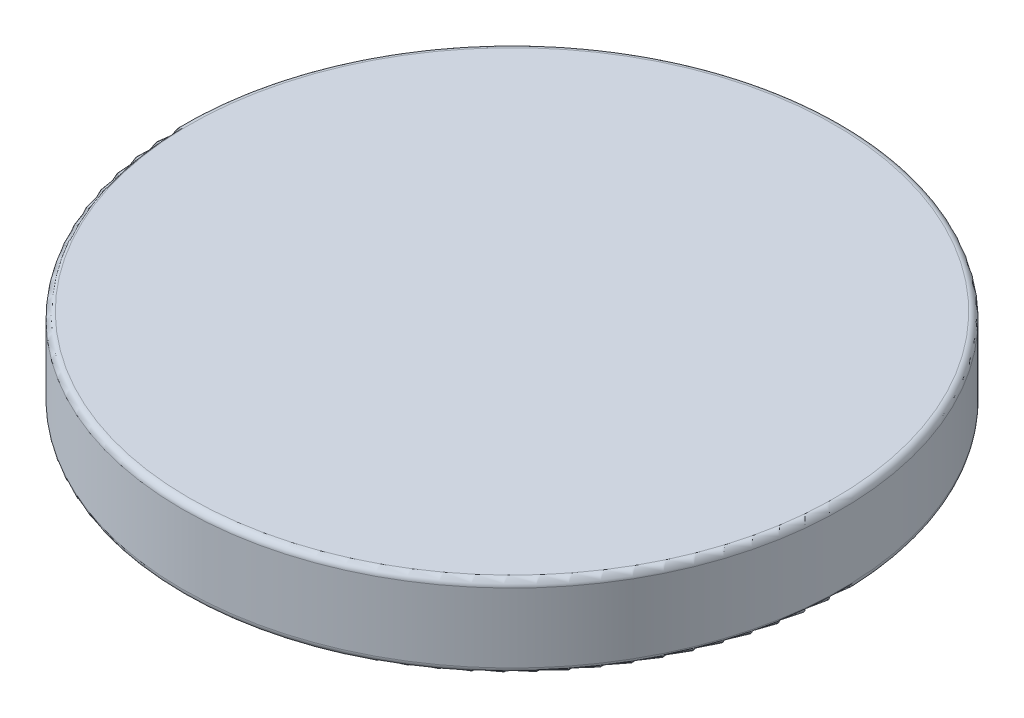
from build123d import *

# Parameters (mm, degrees)
SKETCH1_R           = 12.7
BOSS_EXTRUDE1_DEPTH = 3.175
FILLET1_R           = 0.254


with BuildPart() as part:
    # Sketch1 → Boss-Extrude1 (new body)
    with BuildSketch(Plane(origin=(0, 0, 0), x_dir=(1, 0, 0), z_dir=(0, 1, 0))):
        with Locations(Location((0, 0, 0), (0, 0, 270))):
            Circle(SKETCH1_R)
    extrude(amount=BOSS_EXTRUDE1_DEPTH)

    # Fillet1
    fillet1_edges = [part.edges().sort_by_distance(p)[0] for p in [
        (0, 0, -12.7),
        (0, 3.175, -12.7),
    ]]
    fillet(fillet1_edges, radius=FILLET1_R)


solid = part.part
